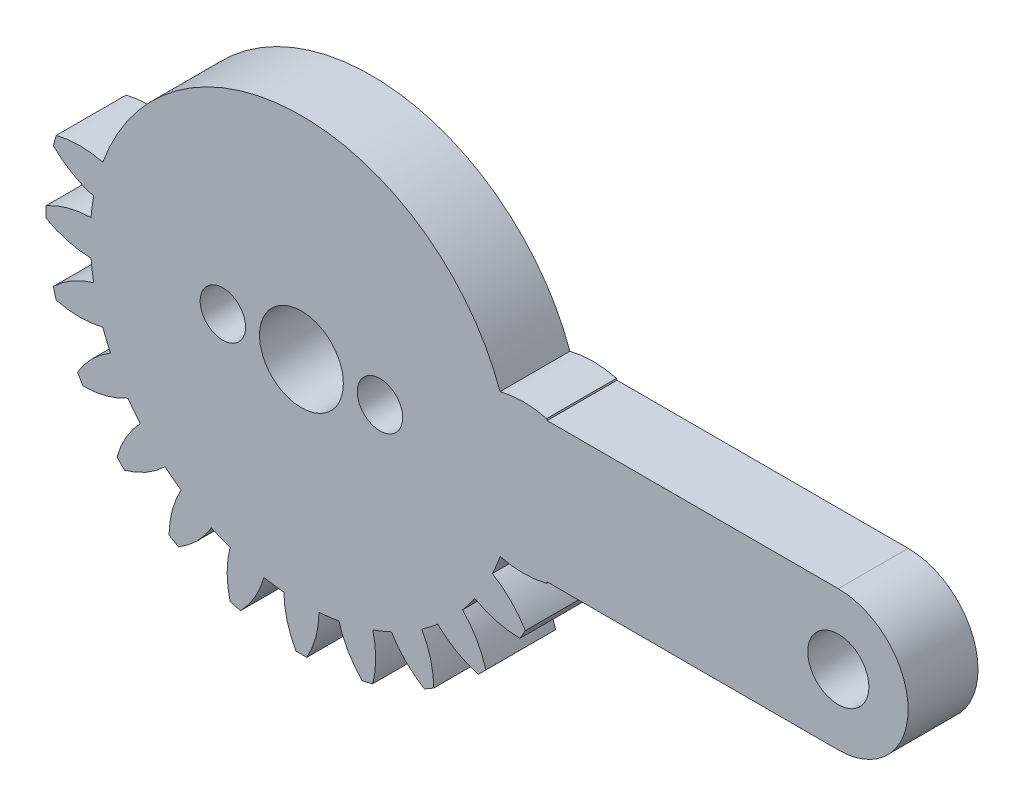
from build123d import *

# Parameters (mm, degrees)
SKETCH1_R           = 1.75
BOSS_EXTRUDE1_DEPTH = 4
SKETCH6_R           = 1.3
SKETCH6_R_2         = 2.4
CUT_EXTRUDE1_DEPTH  = 38.915688046


with BuildPart() as part:
    # Sketch1 → Boss-Extrude1 (new body)
    with BuildSketch(Plane.XY):
        with BuildLine():
            ThreePointArc((14.048088143, -4.085109489), (14.06038767, -4.04257326), (14.072558403, -4))
            Line((14.072558403, -4), (30.75, -4))
            ThreePointArc((30.75, -4), (34.75, 0), (30.75, 4))
            Line((30.75, 4), (14.072558403, 4))
            ThreePointArc((14.072558403, 4), (14.06038767, 4.04257326), (14.048088143, 4.085109489))
            ThreePointArc((14.048088143, 4.085109489), (12.712915648, 4.255390909), (11.377106712, 4.090176385))
            ThreePointArc((11.377106712, 4.090176385), (0, 12.09), (-11.377106712, 4.090176385))
            ThreePointArc((-11.377106712, 4.090176385), (-12.712915648, 4.255390909), (-14.048088143, 4.085109489))
            ThreePointArc((-14.048088143, 4.085109489), (-14.131494839, 3.78652263), (-14.208555951, 3.486235477))
            ThreePointArc((-14.208555951, 3.486235477), (-13.137403362, 2.671181194), (-11.897951627, 2.1463567))
            ThreePointArc((-11.897951627, 2.1463567), (-11.986568374, 1.578061664), (-12.048056748, 1.00619511))
            ThreePointArc((-12.048056748, 1.00619511), (-13.381109763, 0.820047291), (-14.626715284, 0.31))
            ThreePointArc((-14.626715284, 0.31), (-14.63, 0), (-14.626715284, -0.31))
            ThreePointArc((-14.626715284, -0.31), (-13.381109763, -0.820047291), (-12.048056748, -1.00619511))
            ThreePointArc((-12.048056748, -1.00619511), (-11.986568374, -1.578061664), (-11.897951627, -2.1463567))
            ThreePointArc((-11.897951627, -2.1463567), (-13.137403362, -2.671181194), (-14.208555951, -3.486235477))
            ThreePointArc((-14.208555951, -3.486235477), (-14.131494839, -3.78652263), (-14.048088143, -4.085109489))
            ThreePointArc((-14.048088143, -4.085109489), (-12.712915648, -4.255390909), (-11.377106712, -4.090176385))
            ThreePointArc((-11.377106712, -4.090176385), (-11.169703548, -4.626642697), (-10.937020765, -5.152637848))
            ThreePointArc((-10.937020765, -5.152637848), (-11.998404632, -5.980373095), (-12.82210701, -7.044889767))
            ThreePointArc((-12.82210701, -7.044889767), (-12.669951657, -7.315), (-12.51210701, -7.581825517))
            ThreePointArc((-12.51210701, -7.581825517), (-11.17835734, -7.400736668), (-9.930825655, -6.8954189))
            ThreePointArc((-9.930825655, -6.8954189), (-9.591641884, -7.359925677), (-9.230750012, -7.807775241))
            ThreePointArc((-9.230750012, -7.807775241), (-10.041734454, -8.882012453), (-10.561852666, -10.123446462))
            ThreePointArc((-10.561852666, -10.123446462), (-10.344972209, -10.344972209), (-10.123446462, -10.561852666))
            ThreePointArc((-10.123446462, -10.561852666), (-8.882012453, -10.041734454), (-7.807775241, -9.230750012))
            ThreePointArc((-7.807775241, -9.230750012), (-7.359925677, -9.591641884), (-6.8954189, -9.930825655))
            ThreePointArc((-6.8954189, -9.930825655), (-7.400736668, -11.17835734), (-7.581825517, -12.51210701))
            ThreePointArc((-7.581825517, -12.51210701), (-7.315, -12.669951657), (-7.044889767, -12.82210701))
            ThreePointArc((-7.044889767, -12.82210701), (-5.980373095, -11.998404632), (-5.152637848, -10.937020765))
            ThreePointArc((-5.152637848, -10.937020765), (-4.626642697, -11.169703548), (-4.090176385, -11.377106712))
            ThreePointArc((-4.090176385, -11.377106712), (-4.255390909, -12.712915648), (-4.085109489, -14.048088143))
            ThreePointArc((-4.085109489, -14.048088143), (-3.78652263, -14.131494839), (-3.486235477, -14.208555951))
            ThreePointArc((-3.486235477, -14.208555951), (-2.671181194, -13.137403362), (-2.1463567, -11.897951627))
            ThreePointArc((-2.1463567, -11.897951627), (-1.578061664, -11.986568374), (-1.00619511, -12.048056748))
            ThreePointArc((-1.00619511, -12.048056748), (-0.820047291, -13.381109763), (-0.31, -14.626715284))
            ThreePointArc((-0.31, -14.626715284), (0, -14.63), (0.31, -14.626715284))
            ThreePointArc((0.31, -14.626715284), (0.820047291, -13.381109763), (1.00619511, -12.048056748))
            ThreePointArc((1.00619511, -12.048056748), (1.578061664, -11.986568374), (2.1463567, -11.897951627))
            ThreePointArc((2.1463567, -11.897951627), (2.671181194, -13.137403362), (3.486235477, -14.208555951))
            ThreePointArc((3.486235477, -14.208555951), (3.78652263, -14.131494839), (4.085109489, -14.048088143))
            ThreePointArc((4.085109489, -14.048088143), (4.255390909, -12.712915648), (4.090176385, -11.377106712))
            ThreePointArc((4.090176385, -11.377106712), (4.626642697, -11.169703548), (5.152637848, -10.937020765))
            ThreePointArc((5.152637848, -10.937020765), (5.980373095, -11.998404632), (7.044889767, -12.82210701))
            ThreePointArc((7.044889767, -12.82210701), (7.315, -12.669951657), (7.581825517, -12.51210701))
            ThreePointArc((7.581825517, -12.51210701), (7.400736668, -11.17835734), (6.8954189, -9.930825655))
            ThreePointArc((6.8954189, -9.930825655), (7.359925677, -9.591641884), (7.807775241, -9.230750012))
            ThreePointArc((7.807775241, -9.230750012), (8.882012453, -10.041734454), (10.123446462, -10.561852666))
            ThreePointArc((10.123446462, -10.561852666), (10.344972209, -10.344972209), (10.561852666, -10.123446462))
            ThreePointArc((10.561852666, -10.123446462), (10.041734454, -8.882012453), (9.230750012, -7.807775241))
            ThreePointArc((9.230750012, -7.807775241), (9.591641884, -7.359925677), (9.930825655, -6.8954189))
            ThreePointArc((9.930825655, -6.8954189), (11.17835734, -7.400736668), (12.51210701, -7.581825517))
            ThreePointArc((12.51210701, -7.581825517), (12.669951657, -7.315), (12.82210701, -7.044889767))
            ThreePointArc((12.82210701, -7.044889767), (11.998404632, -5.980373095), (10.937020765, -5.152637848))
            ThreePointArc((10.937020765, -5.152637848), (11.169703548, -4.626642697), (11.377106712, -4.090176385))
            ThreePointArc((11.377106712, -4.090176385), (12.712915648, -4.255390909), (14.048088143, -4.085109489))
        make_face()
        Circle(SKETCH1_R, mode=Mode.SUBTRACT)
        with Locations((30.75, 0)):
            Circle(SKETCH1_R, mode=Mode.SUBTRACT)
    extrude(amount=BOSS_EXTRUDE1_DEPTH)

    # Sketch6 → Cut-Extrude1 (cut, through all)
    with BuildSketch(Plane.XY.offset(4)):
        with Locations((4.5, 0)):
            Circle(SKETCH6_R)
        with Locations((-4.5, 0)):
            Circle(SKETCH6_R)
        Circle(SKETCH6_R_2)
    extrude(amount=-CUT_EXTRUDE1_DEPTH, mode=Mode.SUBTRACT)


solid = part.part
